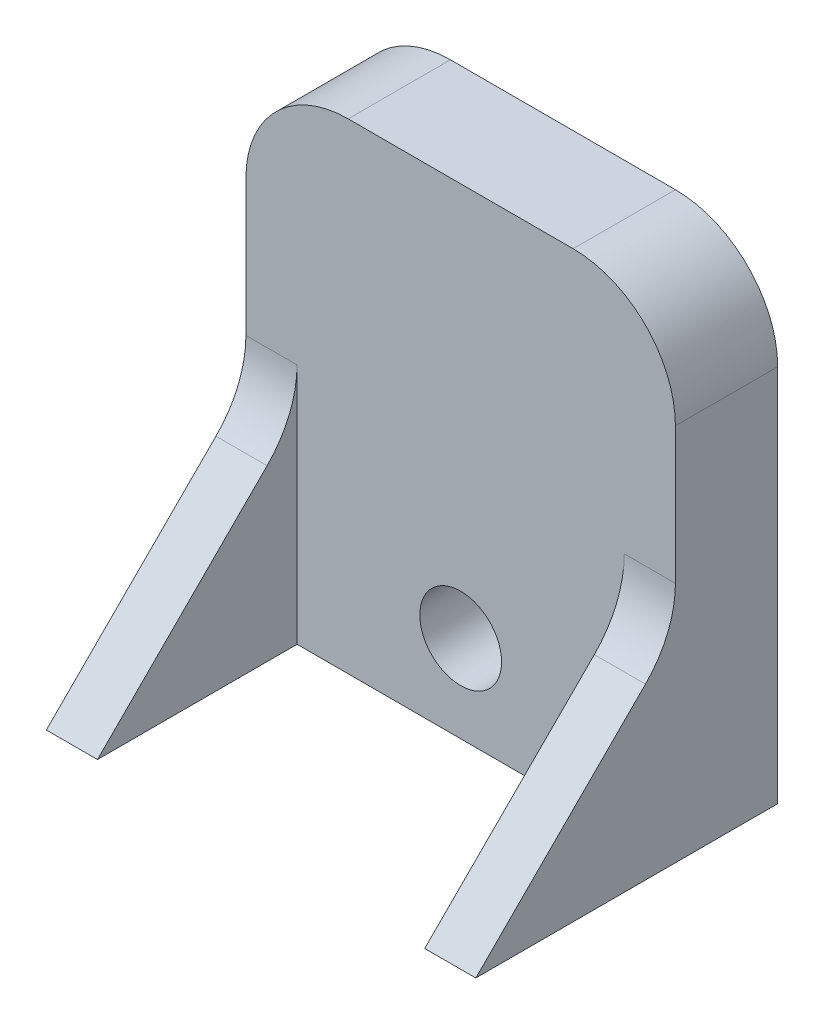
from build123d import *

# Parameters (mm, degrees)
SKETCH1_R            = 4
BOSS_EXTRUDE1_DEPTH  = 10
BOSS_EXTRUDE2_DEPTH  = 5
FILLET1_R            = 10
FILLET1_OF_MIRROR1_R = 10


with BuildPart() as part:
    # Sketch1 → Boss-Extrude1 (new body)
    with BuildSketch(Plane.XY):
        with BuildLine():
            Line((-7.444896481, 27.480652594), (-29.444896481, 27.480652594))
            ThreePointArc((-29.444896481, 27.480652594), (-36.515964293, 24.551720406), (-39.444896481, 17.480652594))
            Line((-39.444896481, 17.480652594), (-39.444896481, -19.519347406))
            Line((-39.444896481, -19.519347406), (2.555103519, -19.519347406))
            Line((2.555103519, -19.519347406), (2.555103519, 17.480652594))
            ThreePointArc((2.555103519, 17.480652594), (-0.373828669, 24.551720406), (-7.444896481, 27.480652594))
        make_face()
        with Locations((-18.444896481, -11.019347406)):
            Circle(SKETCH1_R, mode=Mode.SUBTRACT)
    extrude(amount=-BOSS_EXTRUDE1_DEPTH)

    # Sketch2 → Boss-Extrude2 (add)
    with BuildSketch(Plane.ZY.offset(39.444896481)):
        Polygon((0, -19.519347406), (19.519347406, -19.519347406), (0, 0), align=None)
    boss_extrude2 = extrude(amount=-BOSS_EXTRUDE2_DEPTH)

    # Fillet1
    fillet1_edges = [part.edges().sort_by_distance(p)[0] for p in [
        (-36.944896481, 0, 0),
    ]]
    fillet(fillet1_edges, radius=FILLET1_R)

    # Mirror1: Boss-Extrude2 across plane
    add(boss_extrude2.mirror(Plane(origin=(-18.444896481, 0, 0), x_dir=(0, 0, 1), z_dir=(1, 0, 0))))

    # Fillet1 of Mirror1
    fillet1_of_mirror1_edges = [part.edges().sort_by_distance(p)[0] for p in [
        (0.055103519, 0, 0),
    ]]
    fillet(fillet1_of_mirror1_edges, radius=FILLET1_OF_MIRROR1_R)


solid = part.part
